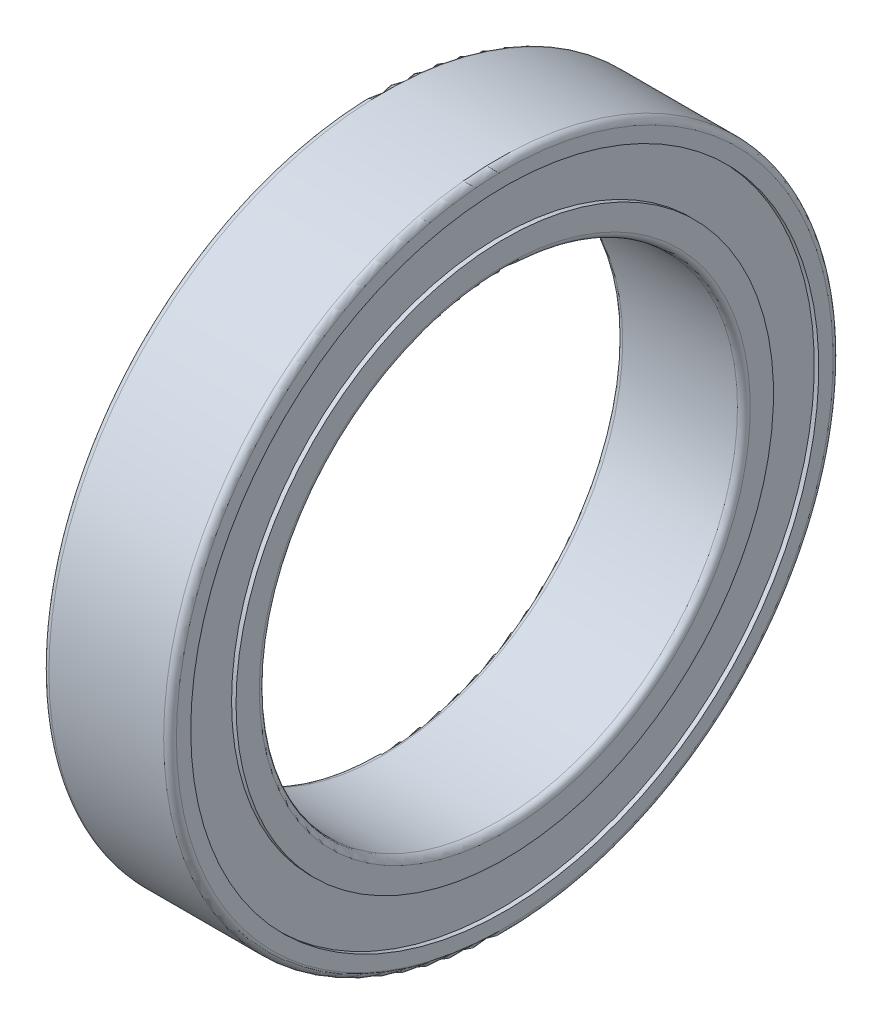
from build123d import *

# Parameters (mm, degrees)
FILLET1_R = 0.2
FILLET2_R = 0.2


with BuildPart() as part:
    # Sketch1 → Revolve1 (revolve)
    with BuildSketch(Plane.XY, mode=Mode.PRIVATE) as revolve1_sk:
        Polygon((0, 7.5), (4, 7.5), (4, 8.43), (3.86, 8.43), (3.86, 9.85), (4, 9.85), (4, 10.5), (0, 10.5), (0, 9.85), (0.14, 9.85), (0.14, 8.43), (0, 8.43), align=None)
    revolve(revolve1_sk.sketch.rotate(Axis((0, 0, 0), (1, 0, 0)), 90), axis=Axis((0, 0, 0), (1, 0, 0)))

    # Fillet1
    fillet1_edges = [part.edges().sort_by_distance(p)[0] for p in [
        (0, 0, -10.5),
        (4, 0, -10.5),
    ]]
    fillet(fillet1_edges, radius=FILLET1_R)

    # Fillet2
    fillet2_edges = [part.edges().sort_by_distance(p)[0] for p in [
        (4, 0, -7.5),
        (0, 0, -7.5),
    ]]
    fillet(fillet2_edges, radius=FILLET2_R)


solid = part.part
